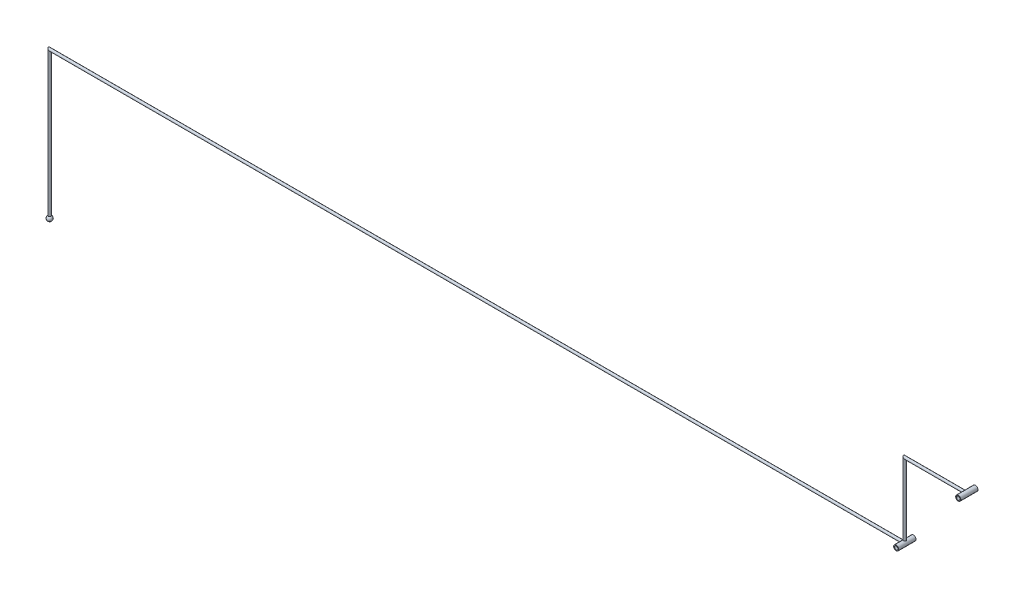
from build123d import *

# Parameters (mm, degrees)
ESQUISSE4_R                  = 1.5
ESQUISSE5_R                  = 3
BOSS_EXTRU_1_DEPTH           = 10
ENL_V_MAT_EXTRU_1_DEPTH      = 1009.974851124
ENL_V_MAT_EXTRU_1_DEPTH_BACK = 1009.974851124
ESQUISSE6_R                  = 2


with BuildPart() as part:
    # Balayage1: sweep along a path in Esquisse3
    with BuildLine(Plane.XY) as balayage1_path:
        Line((-993, -170), (-993, 0))
        Line((-993, 0), (0, 0))
        Line((0, 0), (0, 86))
        Line((0, 86), (72, 86))
    # Esquisse4 → Balayage1 (sweep)
    with BuildSketch(Plane(origin=(-993, -170, 0), x_dir=(1, 0, 0), z_dir=(0, 1, 0))):
        Circle(ESQUISSE4_R)
    sweep(path=balayage1_path.line, transition=Transition.RIGHT)

    # Esquisse5 → Boss.-Extru.1 (add, symmetric)
    with BuildSketch(Plane.XY):
        Circle(ESQUISSE5_R)
        with Locations((72, 86)):
            Circle(ESQUISSE5_R)
    extrude(amount=BOSS_EXTRU_1_DEPTH, both=True)

    # Esquisse6 → Enlèv. mat.-Extru.1 (cut, two sides: drawn at the far end of the back side and taken through both)
    with BuildSketch(Plane.XY.offset(-ENL_V_MAT_EXTRU_1_DEPTH_BACK)):
        with Locations((72, 86)):
            Circle(ESQUISSE6_R)
        Circle(ESQUISSE6_R)
    extrude(amount=ENL_V_MAT_EXTRU_1_DEPTH + ENL_V_MAT_EXTRU_1_DEPTH_BACK, mode=Mode.SUBTRACT)

    # Esquisse7 → Révolution1 (revolve)
    with BuildSketch(Plane.XY):
        with BuildLine():
            Line((-996, -170), (-990, -170))
            ThreePointArc((-990, -170), (-993, -173), (-996, -170))
        make_face()
    revolve(axis=Axis((-996, -170, 0), (1, 0, 0)))


solid = part.part
